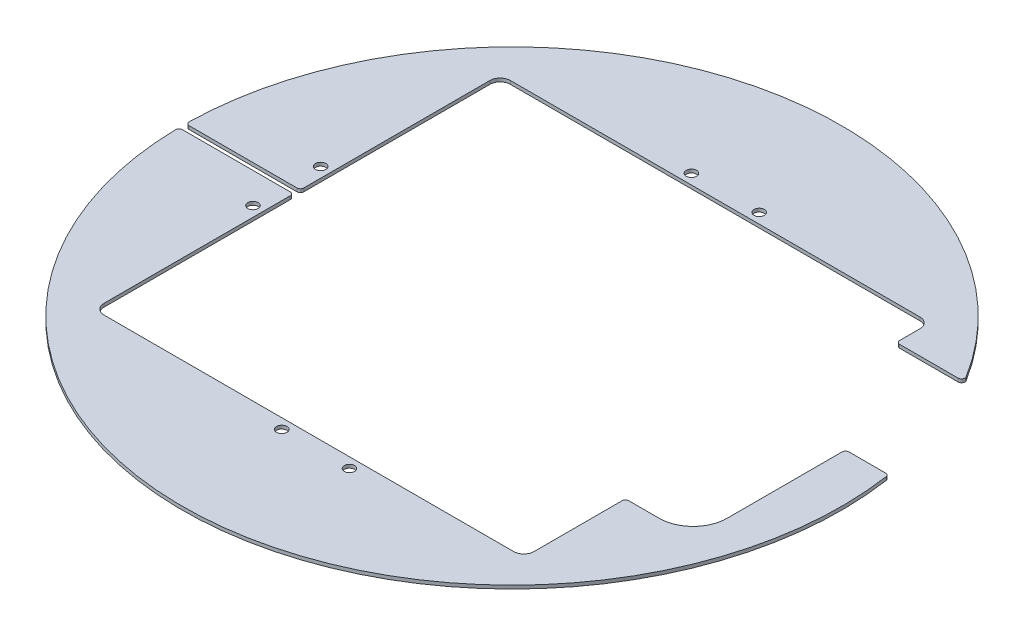
from build123d import *

# Parameters (mm, degrees)
SKETCH_1_R          = 97.362749499
SKETCH_1_W          = 127
SKETCH_1_H          = 120
EXTRUDE_1_DEPTH     = 0.5
CUT_EXTRUDE_1_DEPTH = 16
SKETCH_3_W          = 80
SKETCH_3_H          = 2
CUT_EXTRUDE_2_DEPTH = 11
EXTRUDE_2_DEPTH     = 1
FILLET_1_R          = 3
FILLET_2_R          = 3
FILLET_3_R          = 10
SKETCH_5_R          = 1.525
CUT_EXTRUDE_3_DEPTH = 1
FILLET_4_R          = 1
FILLET_5_R          = 1


with BuildPart() as part:
    # 草图1 → 凸台-拉伸1 (new, symmetric)
    with BuildSketch(Plane(origin=(0, 0, 0), x_dir=(1, 0, 0), z_dir=(0, 1, 0))):
        with Locations(Location((0, 0, 0), (0, 0, 270))):
            Circle(SKETCH_1_R)
        Rectangle(SKETCH_1_W, SKETCH_1_H, mode=Mode.SUBTRACT)
    extrude(amount=EXTRUDE_1_DEPTH, both=True)

    # 草图2 → 切除-拉伸1 (cut, symmetric)
    with BuildSketch(Plane(origin=(0, 0.5, 0), x_dir=(1, 0, 0), z_dir=(0, 1, 0))):
        with BuildLine():
            Line((92.625617353, -30), (63.5, -30))
            Line((63.5, -30), (63.5, 50))
            Line((63.5, 50), (83.543431758, 50))
            ThreePointArc((83.543431758, 50), (96.741322434, 10.982783062), (92.625617353, -30))
        make_face()
    extrude(amount=CUT_EXTRUDE_1_DEPTH, both=True, mode=Mode.SUBTRACT)

    # 草图3 → 切除-拉伸2 (cut, symmetric)
    with BuildSketch(Plane(origin=(0, 0.5, 0), x_dir=(1, 0, 0), z_dir=(0, 1, 0))):
        with Locations((-63.5, 0)):
            Rectangle(SKETCH_3_W, SKETCH_3_H)
    extrude(amount=CUT_EXTRUDE_2_DEPTH, both=True, mode=Mode.SUBTRACT)


with BuildPart() as cut_extrude_2_piece_1:
    # of the separate pieces the step leaves, piece 1, a body of its own (cut_extrude_2_pieces)
    add(part.part.solids().sort_by_distance((92.625617353, -0.5, 30))[0])

    # 草图4 → 凸台-拉伸2 (add)
    with BuildSketch(Plane(origin=(0, 0.5, 0), x_dir=(1, 0, 0), z_dir=(0, 1, 0))):
        with BuildLine():
            Line((83.5, -30), (83.5, 15))
            Line((83.5, 15), (96.200337785, 15))
            ThreePointArc((96.200337785, 15), (97.056995283, -7.710036092), (92.625617353, -30))
            Line((92.625617353, -30), (83.5, -30))
        make_face()
    extrude(amount=-EXTRUDE_2_DEPTH)

    # 圆角1
    fillet_1_edges = [cut_extrude_2_piece_1.edges().sort_by_distance(p)[0] for p in [
        (-63.5, 0, 60),
        (63.5, 0, 60),
    ]]
    fillet(fillet_1_edges, radius=FILLET_1_R)

    # 圆角3
    fillet_3_edges = [cut_extrude_2_piece_1.edges().sort_by_distance(p)[0] for p in [
        (83.5, 0, 30),
    ]]
    fillet(fillet_3_edges, radius=FILLET_3_R)


with BuildPart() as cut_extrude_2_piece_2:
    # of the separate pieces the step leaves, piece 2, a body of its own (cut_extrude_2_pieces)
    add(part.part.solids().sort_by_distance((-97.357613929, -0.5, -1))[0])

    # 圆角2
    fillet_2_edges = [cut_extrude_2_piece_2.edges().sort_by_distance(p)[0] for p in [
        (63.5, 0, -60),
        (-63.5, 0, -60),
    ]]
    fillet(fillet_2_edges, radius=FILLET_2_R)


with BuildPart() as cut_extrude_3_tool:
    # 草图5 → 切除-拉伸3 (new body)
    with BuildSketch(Plane(origin=(0, 0.5, 0), x_dir=(1, 0, 0), z_dir=(0, 1, 0))):
        with Locations(Location((-66.5, 10, 0), (0, 0, 270))):
            Circle(SKETCH_5_R)
        with Locations(Location((-66.5, -10, 0), (0, 0, 270))):
            Circle(SKETCH_5_R)
        with Locations(Location((-10, 63, 0), (0, 0, 270))):
            Circle(SKETCH_5_R)
        with Locations(Location((10, 63, 0), (0, 0, 270))):
            Circle(SKETCH_5_R)
        with Locations(Location((-5, -63, 0), (0, 0, 270))):
            Circle(SKETCH_5_R)
        with Locations(Location((15, -63, 0), (0, 0, 270))):
            Circle(SKETCH_5_R)
    extrude(amount=-CUT_EXTRUDE_3_DEPTH)


with BuildPart() as cut_extrude_2_piece_1_1:
    add(cut_extrude_2_piece_1.part)

    # 切除-拉伸3: cut by cut_extrude_3_tool
    add(cut_extrude_3_tool.part, mode=Mode.SUBTRACT)

    # 圆角4
    fillet_4_edges = [cut_extrude_2_piece_1_1.edges().sort_by_distance(p)[0] for p in [
        (83.5, 0, -15),
        (96.200337785, 0, -15),
        (-97.357613929, 0, 1),
        (63.5, 0, 30),
        (-63.5, 0, 1),
    ]]
    fillet(fillet_4_edges, radius=FILLET_4_R)


with BuildPart() as cut_extrude_2_piece_2_1:
    add(cut_extrude_2_piece_2.part)

    # 切除-拉伸3: cut by cut_extrude_3_tool
    add(cut_extrude_3_tool.part, mode=Mode.SUBTRACT)

    # 圆角5
    fillet_5_edges = [cut_extrude_2_piece_2_1.edges().sort_by_distance(p)[0] for p in [
        (63.5, 0, -50),
        (83.543431758, 0, -50),
        (-63.5, 0, -1),
        (-97.357613929, 0, -1),
    ]]
    fillet(fillet_5_edges, radius=FILLET_5_R)


solid = Compound([cut_extrude_2_piece_1_1.part, cut_extrude_2_piece_2_1.part])
